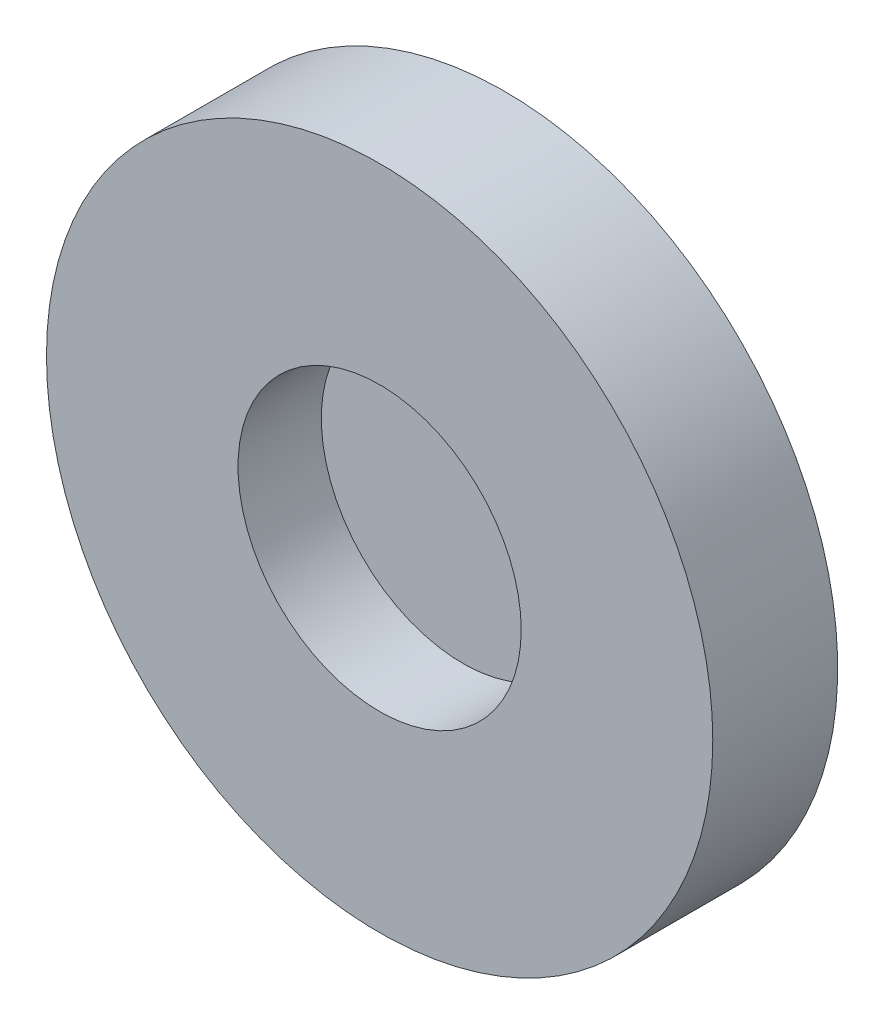
from build123d import *

# Parameters (mm, degrees)
ESQUISSE1_R        = 4
ESQUISSE1_R_2      = 1.7
BOSS_EXTRU_1_DEPTH = 1
BOSS_EXTRU_2_START = 0.5
ESQUISSE2_R        = 4
BOSS_EXTRU_2_DEPTH = 0.5


with BuildPart() as part:
    # Esquisse1 → Boss.-Extru.1 (new body)
    with BuildSketch(Plane.XY):
        Circle(ESQUISSE1_R)
        Circle(ESQUISSE1_R_2, mode=Mode.SUBTRACT)
    extrude(amount=BOSS_EXTRU_1_DEPTH)

    # Esquisse2 → Boss.-Extru.2 (add)
    with BuildSketch(Plane(origin=(0, 0, 0), x_dir=(-1, 0, 0), z_dir=(0, 0, -1)).offset(BOSS_EXTRU_2_START)):
        Circle(ESQUISSE2_R)
    extrude(amount=-BOSS_EXTRU_2_DEPTH)


solid = part.part
